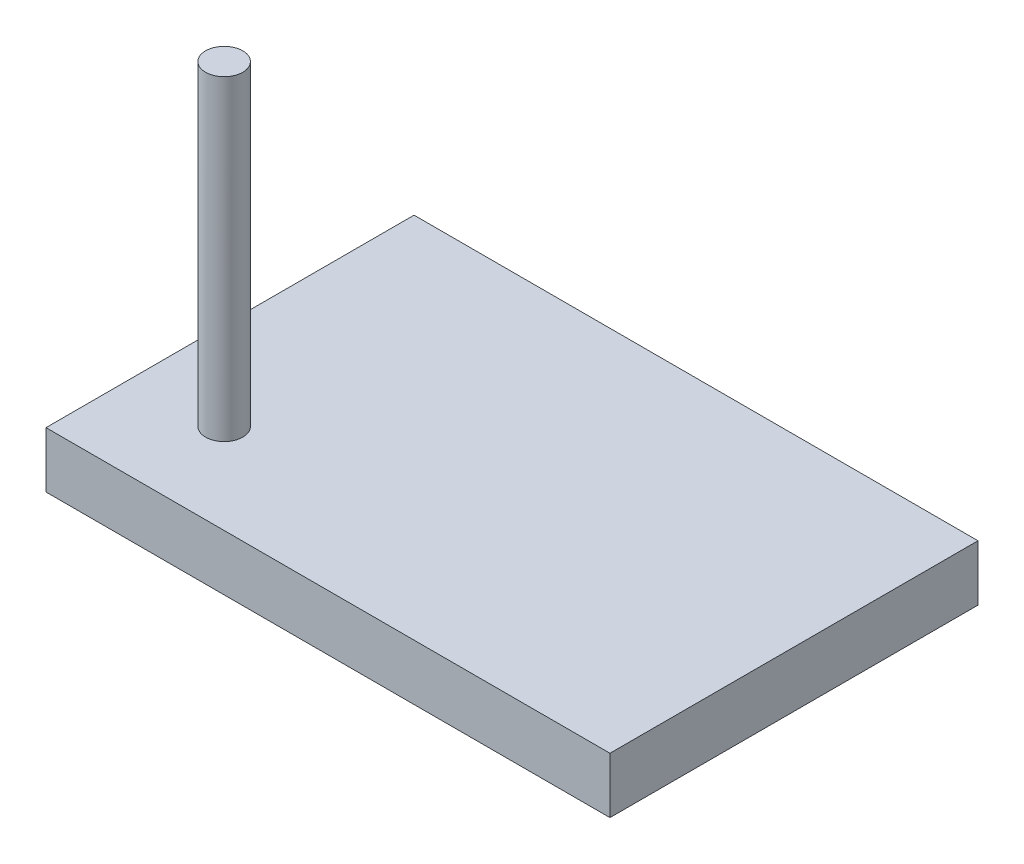
from build123d import *

# Parameters (mm, degrees)
SKETCH1_W           = 151.67647627
SKETCH1_H           = 98.985652184
BOSS_EXTRUDE1_DEPTH = 15
SKETCH2_R           = 5
BOSS_EXTRUDE2_DEPTH = 85


with BuildPart() as part:
    # Sketch1 → Boss-Extrude1 (new body)
    with BuildSketch(Plane(origin=(0, 0, 0), x_dir=(1, 0, 0), z_dir=(0, 1, 0))):
        Rectangle(SKETCH1_W, SKETCH1_H)
    extrude(amount=BOSS_EXTRUDE1_DEPTH)

    # Sketch2 → Boss-Extrude2 (add)
    with BuildSketch(Plane(origin=(0, 15, 0), x_dir=(1, 0, 0), z_dir=(0, 1, 0))):
        with Locations(Location((-52.153895678, -25.255858921, 0), (0, 0, 90))):
            Circle(SKETCH2_R)
    extrude(amount=BOSS_EXTRUDE2_DEPTH)


solid = part.part
